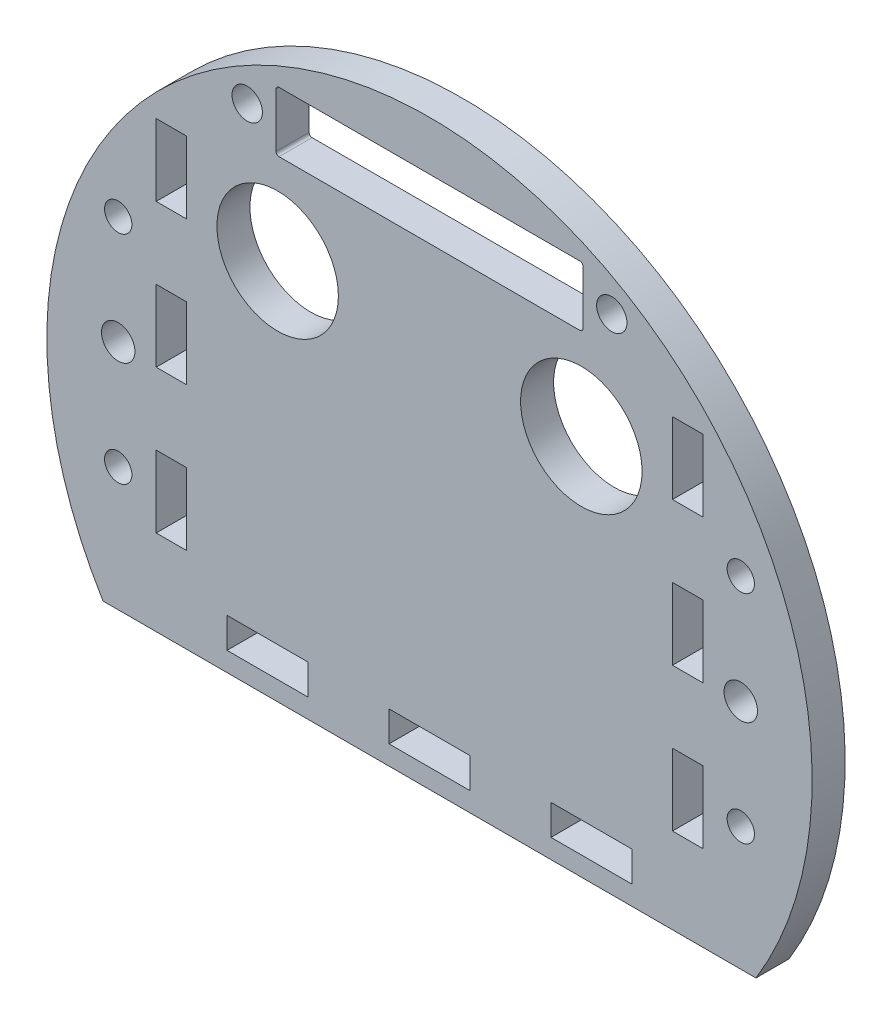
from build123d import *

# Parameters (mm, degrees)
SKETCH1_R           = 2.25
SKETCH1_R_2         = 2.75
SKETCH1_R_3         = 2.5
SKETCH1_R_4         = 10
SKETCH1_W           = 13.333333333
SKETCH1_H           = 4.9958
SKETCH1_W_2         = 4.9958
SKETCH1_H_2         = 11.818181818
SKETCH1_H_3         = 11.818181819
SKETCH1_W_3         = 13.333333334
BOSS_EXTRUDE1_DEPTH = 5.4356


with BuildPart() as part:
    # Sketch1 → Boss-Extrude1 (new body)
    with BuildSketch(Plane.XY):
        with BuildLine():
            Line((-53.750203106, -32.862070326), (53.750203106, -32.862070326))
            ThreePointArc((53.750203106, -32.862070326), (0, 63), (-53.750203106, -32.862070326))
        make_face()
        with Locations((51.25, 23.184046239)):
            Circle(SKETCH1_R, mode=Mode.SUBTRACT)
        with Locations((51.25, -12.496398734)):
            Circle(SKETCH1_R, mode=Mode.SUBTRACT)
        with Locations((-51.25, -12.496398734)):
            Circle(SKETCH1_R, mode=Mode.SUBTRACT)
        with Locations((-51.25, 23.184046239)):
            Circle(SKETCH1_R, mode=Mode.SUBTRACT)
        with Locations((-51.25, 5.343823752)):
            Circle(SKETCH1_R_2, mode=Mode.SUBTRACT)
        with Locations((51.25, 5.343823752)):
            Circle(SKETCH1_R_2, mode=Mode.SUBTRACT)
        with Locations((-30.011103704, 49.928449687)):
            Circle(SKETCH1_R_3, mode=Mode.SUBTRACT)
        with Locations((30.011103704, 49.928449687)):
            Circle(SKETCH1_R_3, mode=Mode.SUBTRACT)
        with Locations((-25, 29.983449687)):
            Circle(SKETCH1_R_4, mode=Mode.SUBTRACT)
        with Locations((25, 29.983449687)):
            Circle(SKETCH1_R_4, mode=Mode.SUBTRACT)
        with BuildLine():
            Line((-24.765, 54.873449687), (24.765, 54.873449687))
            ThreePointArc((24.765, 54.873449687), (25.118553391, 54.727003078), (25.265, 54.373449687))
            Line((25.265, 54.373449687), (25.265, 45.483449687))
            ThreePointArc((25.265, 45.483449687), (25.118553391, 45.129896297), (24.765, 44.983449687))
            Line((24.765, 44.983449687), (-24.765, 44.983449687))
            ThreePointArc((-24.765, 44.983449687), (-25.118553391, 45.129896297), (-25.265, 45.483449687))
            Line((-25.265, 45.483449687), (-25.265, 54.373449687))
            ThreePointArc((-25.265, 54.373449687), (-25.118553391, 54.727003078), (-24.765, 54.873449687))
        make_face(mode=Mode.SUBTRACT)
        with Locations((-26.666666666, -27.189170326)):
            Rectangle(SKETCH1_W, SKETCH1_H, mode=Mode.SUBTRACT)
        with Locations((42.4979, 34.399638765)):
            Rectangle(SKETCH1_W_2, SKETCH1_H_2, mode=Mode.SUBTRACT)
        with Locations((42.4979, 10.763275129)):
            Rectangle(SKETCH1_W_2, SKETCH1_H_3, mode=Mode.SUBTRACT)
        with Locations((-42.4979, 34.399638765)):
            Rectangle(SKETCH1_W_2, SKETCH1_H_2, mode=Mode.SUBTRACT)
        with Locations((-42.4979, 10.763275129)):
            Rectangle(SKETCH1_W_2, SKETCH1_H_3, mode=Mode.SUBTRACT)
        with Locations((-42.4979, -12.873088508)):
            Rectangle(SKETCH1_W_2, SKETCH1_H_2, mode=Mode.SUBTRACT)
        with Locations((42.4979, -12.873088508)):
            Rectangle(SKETCH1_W_2, SKETCH1_H_2, mode=Mode.SUBTRACT)
        with Locations((0, -27.189170326)):
            Rectangle(SKETCH1_W_3, SKETCH1_H, mode=Mode.SUBTRACT)
        with Locations((26.666666666, -27.189170326)):
            Rectangle(SKETCH1_W, SKETCH1_H, mode=Mode.SUBTRACT)
    extrude(amount=BOSS_EXTRUDE1_DEPTH)


solid = part.part
